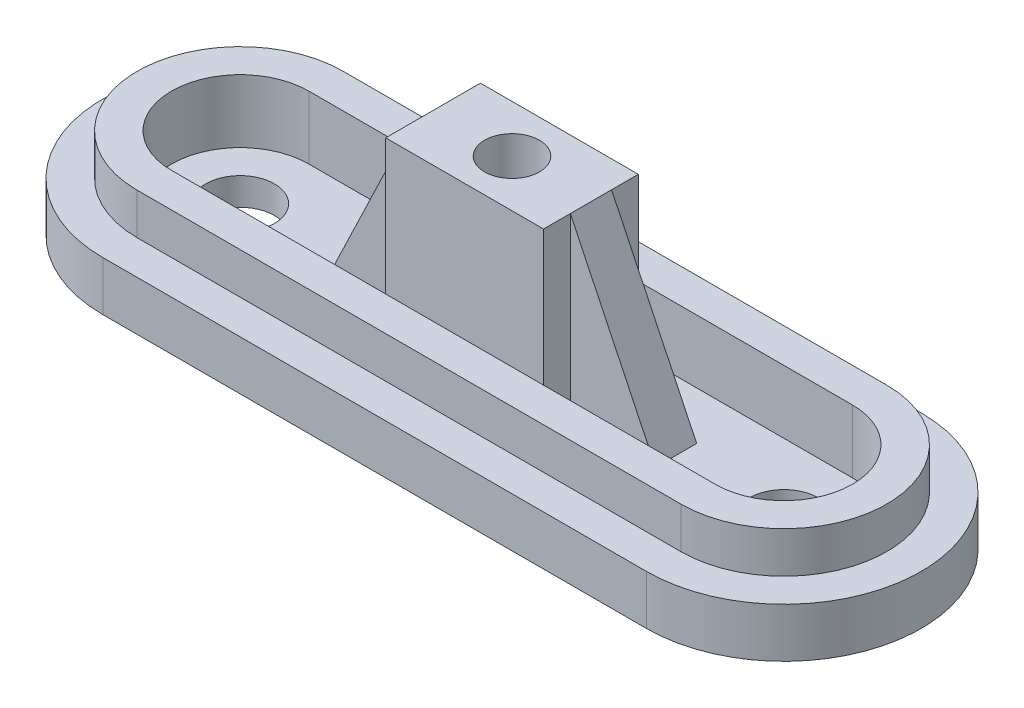
from build123d import *

# Parameters (mm, degrees)
BOSS_EXTRUDE2_DEPTH = 36
BOSS_EXTRUDE3_DEPTH = 66
SKETCH1_7_R         = 25
BOSS_EXTRUDE4_DEPTH = 20
SKETCH1_8_W         = 115
SKETCH1_8_H         = 69
SKETCH1_8_R         = 20
BOSS_EXTRUDE5_DEPTH = 149
SKETCH1_10_W        = 62
SKETCH1_10_H        = 30
BOSS_EXTRUDE6_DEPTH = 20
RIB2_REACH          = 354.463
SKETCH5_WALL_W      = 850.051346756
SKETCH5_WALL_H      = 30


with BuildPart() as part:
    # Sketch1 → Boss-Extrude2 (new body)
    with BuildSketch(Plane(origin=(0, 0, 0), x_dir=(1, 0, 0), z_dir=(0, 1, 0))):
        with BuildLine():
            ThreePointArc((198, 100), (298, 0), (198, -100))
            Line((198, -100), (-198, -100))
            ThreePointArc((-198, -100), (-298, 0), (-198, 100))
            Line((-198, 100), (198, 100))
        make_face()
        with BuildLine():
            ThreePointArc((198, -75), (273, 0), (198, 75))
            Line((198, 75), (-198, 75))
            ThreePointArc((-198, 75), (-273, 0), (-198, -75))
            Line((-198, -75), (198, -75))
        make_face(mode=Mode.SUBTRACT)
    extrude(amount=BOSS_EXTRUDE2_DEPTH)

    # Sketch1<6> → Boss-Extrude3 (add)
    with BuildSketch(Plane(origin=(0, 0, 0), x_dir=(1, 0, 0), z_dir=(0, 1, 0))):
        with BuildLine():
            Line((-198, -75), (198, -75))
            ThreePointArc((198, -75), (273, 0), (198, 75))
            Line((198, 75), (-198, 75))
            ThreePointArc((-198, 75), (-273, 0), (-198, -75))
        make_face()
        with BuildLine():
            Line((-198, 50), (198, 50))
            ThreePointArc((198, 50), (248, 0), (198, -50))
            Line((198, -50), (-198, -50))
            ThreePointArc((-198, -50), (-248, 0), (-198, 50))
        make_face(mode=Mode.SUBTRACT)
    extrude(amount=BOSS_EXTRUDE3_DEPTH)

    # Sketch1<7> → Boss-Extrude4 (add)
    with BuildSketch(Plane(origin=(0, 0, 0), x_dir=(1, 0, 0), z_dir=(0, 1, 0))):
        with BuildLine():
            Line((198, 50), (-198, 50))
            ThreePointArc((-198, 50), (-248, 0), (-198, -50))
            Line((-198, -50), (198, -50))
            ThreePointArc((198, -50), (248, 0), (198, 50))
        make_face()
        with Locations(Location((-198, 0, 0), (0, 0, 270))):
            Circle(SKETCH1_7_R, mode=Mode.SUBTRACT)
        Polygon((57.5, -34.5), (-57.5, -34.5), (-57.5, -15), (-119.5, -15), (-119.5, 15), (-57.5, 15), (-57.5, 34.5), (57.5, 34.5), (57.5, 15), (119.5, 15), (119.5, -15), (57.5, -15), align=None, mode=Mode.SUBTRACT)
        with Locations(Location((198, 0, 0), (0, 0, 270))):
            Circle(SKETCH1_7_R, mode=Mode.SUBTRACT)
    extrude(amount=BOSS_EXTRUDE4_DEPTH)

    # Sketch1<8> → Boss-Extrude5 (add)
    with BuildSketch(Plane(origin=(0, 0, 0), x_dir=(1, 0, 0), z_dir=(0, 1, 0))):
        Rectangle(SKETCH1_8_W, SKETCH1_8_H)
        with Locations(Location((0, 0, 0), (0, 0, 270))):
            Circle(SKETCH1_8_R, mode=Mode.SUBTRACT)
    extrude(amount=BOSS_EXTRUDE5_DEPTH)

    # Sketch1<10> → Boss-Extrude6 (add)
    with BuildSketch(Plane(origin=(0, 0, 0), x_dir=(1, 0, 0), z_dir=(0, 1, 0))):
        with Locations((-88.5, 0)):
            Rectangle(SKETCH1_10_W, SKETCH1_10_H)
        with Locations((88.5, 0)):
            Rectangle(SKETCH1_10_W, SKETCH1_10_H)
    extrude(amount=BOSS_EXTRUDE6_DEPTH)

    # Sketch5 wall → Rib2 (add, up to next)
    with BuildSketch(Plane(origin=(-88.5, 84.5, 15), x_dir=(0.433185294803, 0.901304887575, 0), z_dir=(0.901304887575, -0.433185294803, 0)), mode=Mode.PRIVATE) as rib2_sk1:
        with Locations((0, -15)):
            Rectangle(SKETCH5_WALL_W, SKETCH5_WALL_H)
    rib2_tool1 = extrude(rib2_sk1.sketch, amount=RIB2_REACH, mode=Mode.PRIVATE) - part.part
    rib2 = rib2_tool1.solids().sort_by_distance((-88.5, 84.5, 15))[0]
    add(rib2)

    # Mirror1: Rib2 across plane
    add(rib2.mirror(Plane(origin=(0, 0, 0), x_dir=(0, 0, 1), z_dir=(1, 0, 0))))


solid = part.part
